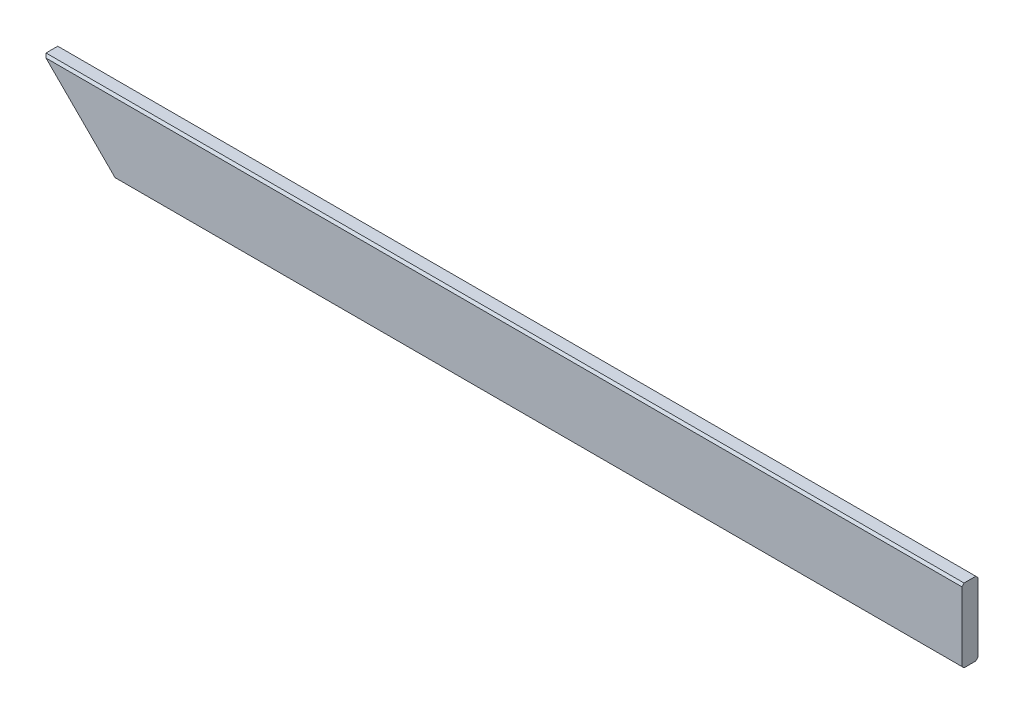
from build123d import *

# Parameters (mm, degrees)
ESQUISSE1_W                  = 1950
ESQUISSE1_H                  = 100
BOSS_EXTRU_1_DEPTH           = 22
ENL_V_MAT_EXTRU_1_DEPTH      = 1953.686354743
ENL_V_MAT_EXTRU_1_DEPTH_BACK = 1953.686354743
CHANFREIN1_SIZE              = 3


with BuildPart() as part:
    # Esquisse1 → Boss.-Extru.1 (new body)
    with BuildSketch(Plane.XY):
        with Locations((975, 50)):
            Rectangle(ESQUISSE1_W, ESQUISSE1_H)
    extrude(amount=BOSS_EXTRU_1_DEPTH)

    # Esquisse2 → Enlèv. mat.-Extru.1 (cut, two sides: drawn at the far end of the back side and taken through both)
    with BuildSketch(Plane(origin=(0, 0, 0), x_dir=(-1, 0, 0), z_dir=(0, 0, -1)).offset(-ENL_V_MAT_EXTRU_1_DEPTH_BACK)):
        Polygon((0, 0), (-800, 0), (-700, 100), (0, 100), align=None)
    extrude(amount=ENL_V_MAT_EXTRU_1_DEPTH + ENL_V_MAT_EXTRU_1_DEPTH_BACK, mode=Mode.SUBTRACT)

    # Chanfrein1
    chanfrein1_edges = [part.edges().sort_by_distance(p)[0] for p in [
        (1325, 100, 22),
        (1375, 0, 0),
        (1375, 0, 22),
        (1325, 100, 0),
    ]]
    chamfer(chanfrein1_edges, length=CHANFREIN1_SIZE)


solid = part.part
